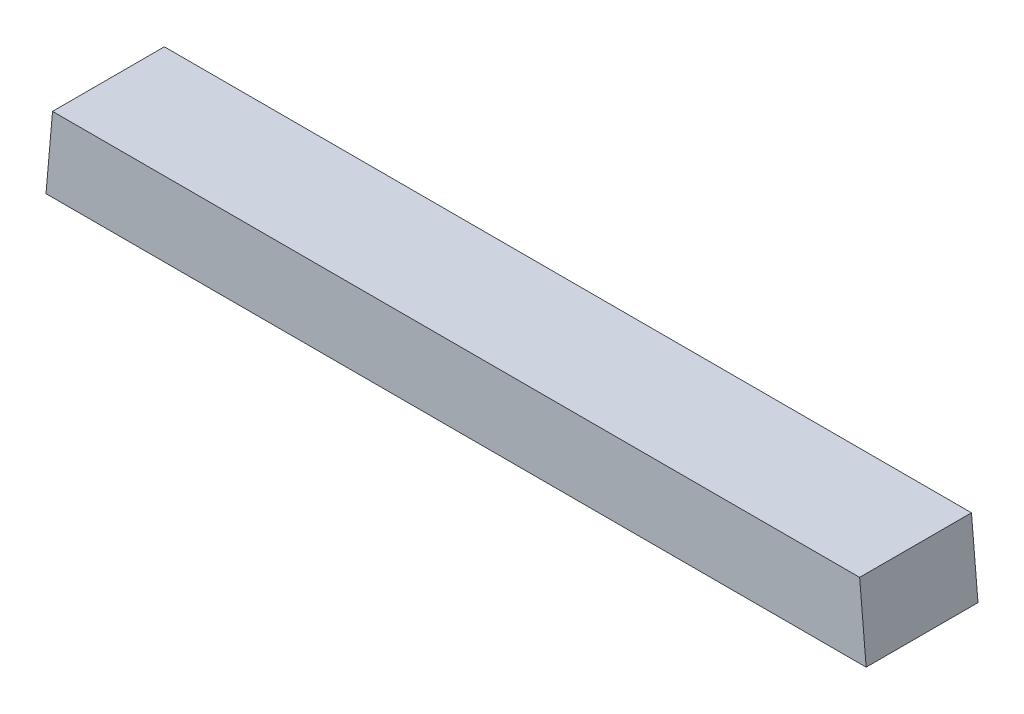
from build123d import *

# Parameters (mm, degrees)
ESQUISSE1_W                  = 220
ESQUISSE1_H                  = 20
BOSS_EXTRU_1_DEPTH           = 30
ENL_V_MAT_EXTRU_1_DEPTH      = 223.934968096
ENL_V_MAT_EXTRU_1_DEPTH_BACK = 223.934968096


with BuildPart() as part:
    # Esquisse1 → Boss.-Extru.1 (new body)
    with BuildSketch(Plane.XY):
        with Locations((110, 10)):
            Rectangle(ESQUISSE1_W, ESQUISSE1_H)
    extrude(amount=BOSS_EXTRU_1_DEPTH)

    # Esquisse2 → Enlèv. mat.-Extru.1 (cut, two sides: drawn at the far end of the back side and taken through both)
    with BuildSketch(Plane.XY.offset(30).offset(-ENL_V_MAT_EXTRU_1_DEPTH_BACK)):
        Polygon((0, 0), (1.749773271, 20), (0, 20), align=None)
        Polygon((220, 20), (220, 0), (218.250226729, 20), align=None)
    extrude(amount=ENL_V_MAT_EXTRU_1_DEPTH + ENL_V_MAT_EXTRU_1_DEPTH_BACK, mode=Mode.SUBTRACT)


solid = part.part
